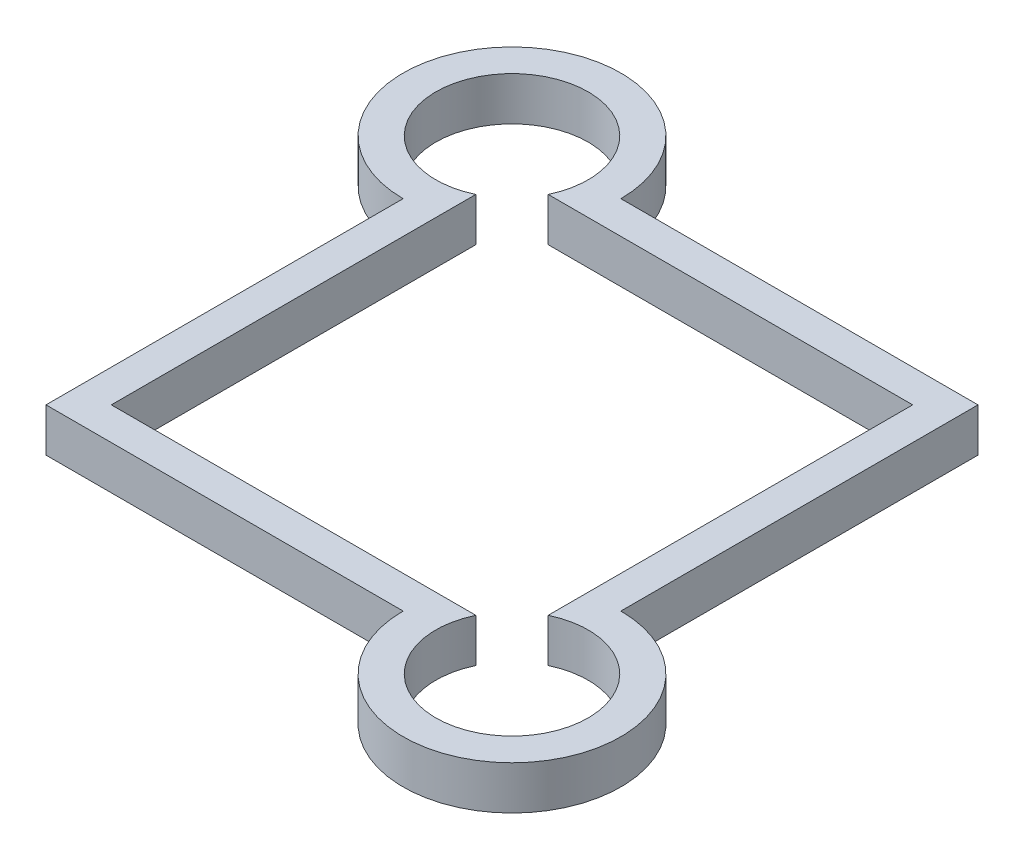
from build123d import *

# Parameters (mm, degrees)
Y_KSEKLIK_EKSTR_ZYON1_DEPTH = 20


with BuildPart() as part:
    # Çizim1 → Yükseklik-Ekstrüzyon1 (new body)
    with BuildSketch(Plane(origin=(0, 0, 0), x_dir=(1, 0, 0), z_dir=(0, 1, 0))):
        with BuildLine():
            Line((-47.84660767, 82.380530973), (116.15339233, 82.380530973))
            Line((116.15339233, 82.380530973), (116.15339233, -81.619469027))
            ThreePointArc((116.15339233, -81.619469027), (151.50873139, -166.974808086), (66.15339233, -131.619469027))
            Line((66.15339233, -131.619469027), (-97.84660767, -131.619469027))
            Line((-97.84660767, -131.619469027), (-97.84660767, 32.380530973))
            ThreePointArc((-97.84660767, 32.380530973), (-133.201946729, 117.735870033), (-47.84660767, 82.380530973))
        make_face()
        with BuildLine():
            Line((-66.223831068, 67.380530973), (101.15339233, 67.380530973))
            Line((101.15339233, 67.380530973), (101.15339233, -99.996692425))
            ThreePointArc((101.15339233, -99.996692425), (140.902129672, -156.368206368), (84.530615729, -116.619469027))
            Line((84.530615729, -116.619469027), (-82.84660767, -116.619469027))
            Line((-82.84660767, -116.619469027), (-82.84660767, 50.757754372))
            ThreePointArc((-82.84660767, 50.757754372), (-122.595345011, 107.129268315), (-66.223831068, 67.380530973))
        make_face(mode=Mode.SUBTRACT)
    extrude(amount=Y_KSEKLIK_EKSTR_ZYON1_DEPTH)


solid = part.part
